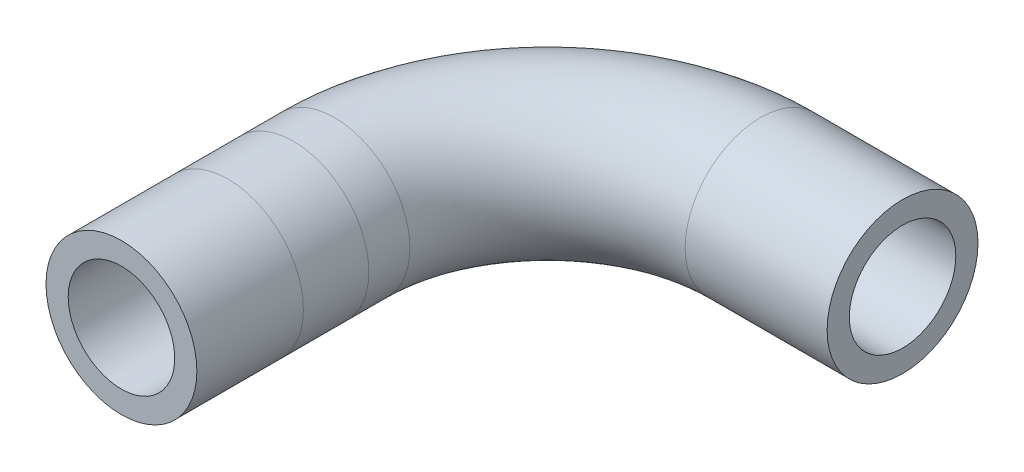
from build123d import *

# Parameters (mm, degrees)
SWEEP1_PROFILE_R     = 13.49375
CUT_SWEEP1_PROFILE_R = 9.525


with BuildPart() as part:
    # Sweep1: sweep along a curve in space
    with BuildLine() as sweep1_path:
        Line((-39.450636639, 0, 30.750046958), (-39.450636639, 0, 11.700046958))
        Line((-39.450636639, 0, 0), (-39.450636639, 0, 11.700046958))
        Line((-39.450636639, 0, -7.349953042), (-39.450636639, 0, 0))
        ThreePointArc((-39.450636639, 0, -7.349953042), (-28.291405002, 0, -34.290721405), (-1.350636639, 0, -45.449953042))
        Line((-1.350636639, 0, -45.449953042), (24.049363361, 0, -45.449953042))
    # Sweep1 profile (on start of the path) → Sweep1 (sweep)
    with BuildSketch(Plane(origin=(-39.450636639, 0, 30.750046958), x_dir=(-1, 0, 0), z_dir=(0, 0, -1))):
        Circle(SWEEP1_PROFILE_R)
    sweep(path=sweep1_path.line)

    # Cut-Sweep1: sweep along a curve in space
    with BuildLine() as cut_sweep1_path:
        Line((-39.450636639, 0, 30.750046958), (-39.450636639, 0, 11.700046958))
        Line((-39.450636639, 0, 0), (-39.450636639, 0, 11.700046958))
        Line((-39.450636639, 0, -7.349953042), (-39.450636639, 0, 0))
        ThreePointArc((-39.450636639, 0, -7.349953042), (-28.291405002, 0, -34.290721405), (-1.350636639, 0, -45.449953042))
        Line((-1.350636639, 0, -45.449953042), (24.049363361, 0, -45.449953042))
    # Cut-Sweep1 profile (on start of the path) → Cut-Sweep1 (sweep, cut)
    with BuildSketch(Plane(origin=(-39.450636639, 0, 30.750046958), x_dir=(-1, 0, 0), z_dir=(0, 0, -1))):
        Circle(CUT_SWEEP1_PROFILE_R)
    sweep(path=cut_sweep1_path.line, mode=Mode.SUBTRACT)


solid = part.part
